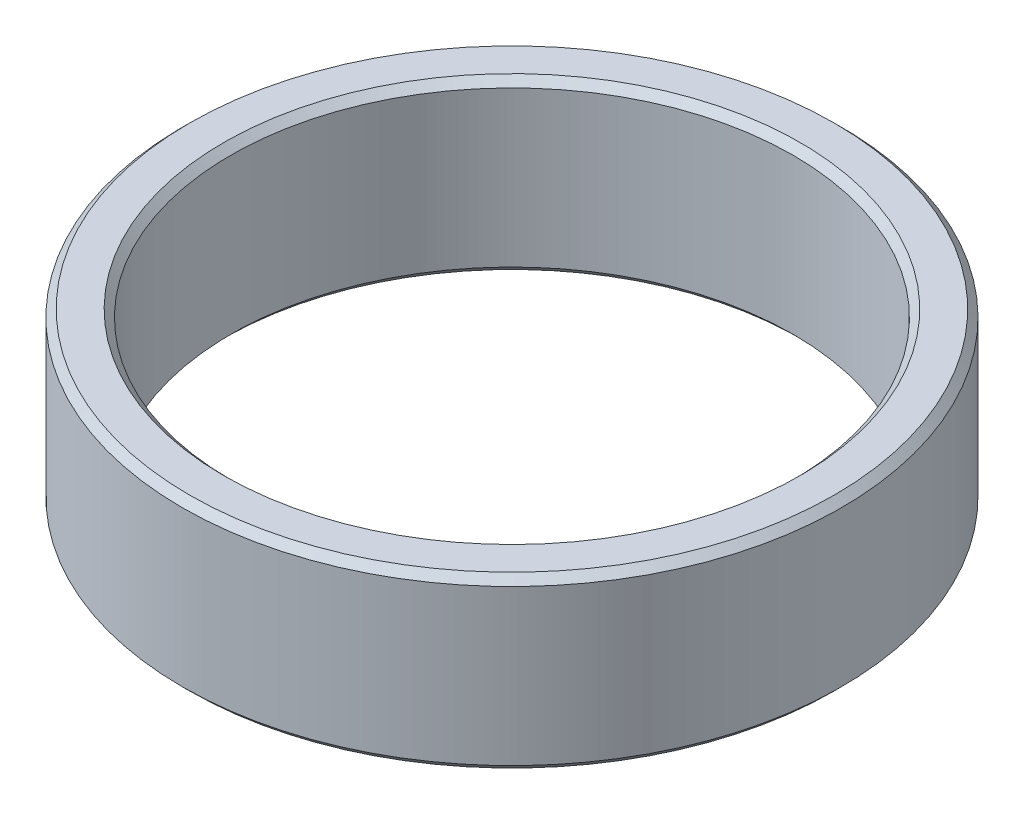
from build123d import *

# Parameters (mm, degrees)
SKETCH_1_R      = 13.6
SKETCH_1_R_2    = 11.6
EXTRUDE_1_DEPTH = 7
CHAMFER_1_SIZE  = 0.3


with BuildPart() as part:
    # 草图1 → 凸台-拉伸1 (new body)
    with BuildSketch(Plane(origin=(0, 0, 0), x_dir=(1, 0, 0), z_dir=(0, 1, 0))):
        with Locations(Location((0, 0, 0), (0, 0, 270))):
            Circle(SKETCH_1_R)
        with Locations(Location((0, 0, 0), (0, 0, 270))):
            Circle(SKETCH_1_R_2, mode=Mode.SUBTRACT)
    extrude(amount=EXTRUDE_1_DEPTH)

    # 倒角1
    chamfer_1_edges = [part.edges().sort_by_distance(p)[0] for p in [
        (0, 0, -13.6),
        (0, 7, -13.6),
        (0, 0, -11.6),
        (0, 7, -11.6),
    ]]
    chamfer(chamfer_1_edges, length=CHAMFER_1_SIZE)


solid = part.part
